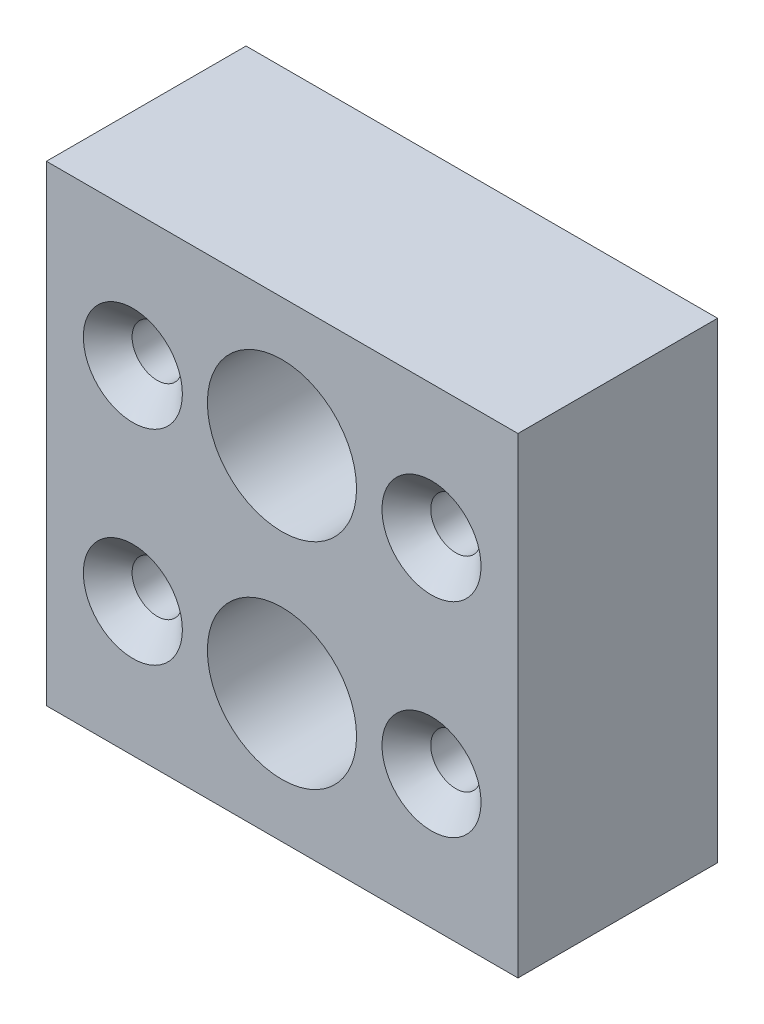
from build123d import *

# Parameters (mm, degrees)
SKETCH1_W                                       = 30
SKETCH1_H                                       = 30
BOSS_EXTRUDE1_DEPTH                             = 12.7
CSK_FOR_M3_FLAT_HEAD_MACHINE_SCREW1_D           = 3.2
CSK_FOR_M3_FLAT_HEAD_MACHINE_SCREW1_CSINK_D     = 6.3
CSK_FOR_M3_FLAT_HEAD_MACHINE_SCREW1_CSINK_ANGLE = 90


with BuildPart() as part:
    # Sketch1 → Boss-Extrude1 (new body)
    with BuildSketch(Plane.XY):
        Rectangle(SKETCH1_W, SKETCH1_H)
        with BuildLine():
            ThreePointArc((-8.9105463, -5.42101224), (-10.57898776, -5.9105463), (-10.0894537, -7.57898776))
            ThreePointArc((-10.0894537, -7.57898776), (-8.42101224, -7.0894537), (-8.9105463, -5.42101224))
        make_face(mode=Mode.SUBTRACT)
        with BuildLine():
            ThreePointArc((-8.9105463, 7.57898776), (-10.57898776, 7.0894537), (-10.0894537, 5.42101224))
            ThreePointArc((-10.0894537, 5.42101224), (-8.42101224, 5.9105463), (-8.9105463, 7.57898776))
        make_face(mode=Mode.SUBTRACT)
        with BuildLine():
            ThreePointArc((10.0894537, 7.57898776), (8.42101224, 7.0894537), (8.9105463, 5.42101224))
            ThreePointArc((8.9105463, 5.42101224), (10.57898776, 5.9105463), (10.0894537, 7.57898776))
        make_face(mode=Mode.SUBTRACT)
        with BuildLine():
            ThreePointArc((10.0894537, -5.42101224), (8.42101224, -5.9105463), (8.9105463, -7.57898776))
            ThreePointArc((8.9105463, -7.57898776), (10.57898776, -7.0894537), (10.0894537, -5.42101224))
        make_face(mode=Mode.SUBTRACT)
        with BuildLine():
            add(Edge.make_bspline(
                [(-1.342391508, -9.257231173), (-1.831415943, -8.990075907), (-2.180549698, -8.556474598), (-2.530193945, -8.122239293), (-2.686738964, -7.588310687), (-2.84359347, -7.053326516), (-2.783896578, -6.500133621), (-2.724081666, -5.945847074), (-2.457231173, -5.457608492), (-2.189853123, -4.968404672), (-1.756474598, -4.619450302), (-1.322239293, -4.269806055), (-0.788310687, -4.113261036), (-0.253326516, -3.95640653), (0.299866379, -4.016103422), (0.853868841, -4.075887677), (1.342391508, -4.342768827)],
                knots=[0, 0, 0, 0.125, 0.125, 0.25, 0.25, 0.375, 0.375, 0.5, 0.5, 0.625, 0.625, 0.75, 0.75, 0.875, 0.875, 1, 1, 1], degree=2))
            add(Edge.make_bspline(
                [(1.342391508, -4.342768827), (1.831415943, -4.609924093), (2.180549698, -5.043525402), (2.530193945, -5.477760707), (2.686738964, -6.011689313), (2.84359347, -6.546673484), (2.783896578, -7.099866379), (2.724081666, -7.654152926), (2.457231173, -8.142391508), (2.189853123, -8.631595328), (1.756474598, -8.980549698), (1.322239293, -9.330193945), (0.788310687, -9.486738964), (0.253326516, -9.64359347), (-0.299866379, -9.583896578), (-0.853868841, -9.524112323), (-1.342391508, -9.257231173)],
                knots=[0, 0, 0, 0.125, 0.125, 0.25, 0.25, 0.375, 0.375, 0.5, 0.5, 0.625, 0.625, 0.75, 0.75, 0.875, 0.875, 1, 1, 1], degree=2))
        make_face(mode=Mode.SUBTRACT)
        with BuildLine():
            add(Edge.make_bspline(
                [(1.342391508, 9.257231173), (1.831415943, 8.990075907), (2.180549698, 8.556474598), (2.530193945, 8.122239293), (2.686738964, 7.588310687), (2.84359347, 7.053326516), (2.783896578, 6.500133621), (2.724081666, 5.945847074), (2.457231173, 5.457608492), (2.189853123, 4.968404672), (1.756474598, 4.619450302), (1.322239293, 4.269806055), (0.788310687, 4.113261036), (0.253326516, 3.95640653), (-0.299866379, 4.016103422), (-0.853868841, 4.075887677), (-1.342391508, 4.342768827)],
                knots=[0, 0, 0, 0.125, 0.125, 0.25, 0.25, 0.375, 0.375, 0.5, 0.5, 0.625, 0.625, 0.75, 0.75, 0.875, 0.875, 1, 1, 1], degree=2))
            add(Edge.make_bspline(
                [(-1.342391508, 4.342768827), (-1.831415943, 4.609924093), (-2.180549698, 5.043525402), (-2.530193945, 5.477760707), (-2.686738964, 6.011689313), (-2.84359347, 6.546673484), (-2.783896578, 7.099866379), (-2.724081666, 7.654152926), (-2.457231173, 8.142391508), (-2.189853123, 8.631595328), (-1.756474598, 8.980549698), (-1.322239293, 9.330193945), (-0.788310687, 9.486738964), (-0.253326516, 9.64359347), (0.299866379, 9.583896578), (0.853868841, 9.524112323), (1.342391508, 9.257231173)],
                knots=[0, 0, 0, 0.125, 0.125, 0.25, 0.25, 0.375, 0.375, 0.5, 0.5, 0.625, 0.625, 0.75, 0.75, 0.875, 0.875, 1, 1, 1], degree=2))
        make_face(mode=Mode.SUBTRACT)
    extrude(amount=BOSS_EXTRUDE1_DEPTH)

    # CSK for M3 Flat Head Machine Screw1 (through all)
    with Locations(Plane.XY.offset(12.7)):
        with Locations((-9.5, -6.5), (-9.5, 6.5), (9.5, 6.5), (9.5, -6.5)):
            CounterSinkHole(CSK_FOR_M3_FLAT_HEAD_MACHINE_SCREW1_D / 2, CSK_FOR_M3_FLAT_HEAD_MACHINE_SCREW1_CSINK_D / 2, counter_sink_angle=CSK_FOR_M3_FLAT_HEAD_MACHINE_SCREW1_CSINK_ANGLE)

    # Sketch10 → 1/8 NPT Tapped Hole1 (revolve, cut)
    with BuildSketch(Plane(origin=(-0.014274842, -6.826129923, 12.7), x_dir=(0, -1, 0), z_dir=(1, 0, 0))):
        Polygon((0, 0), (0, 12.134668714), (4.2164, 9.6012), (4.2164, 6.92), (4.537398933, 6.92), (4.744593, 0), align=None)
    f_1_8_npt_tapped_hole1 = revolve(axis=Axis((-0.014274842, -6.826129923, 19.05), (0, 0, -1)), mode=Mode.SUBTRACT)

    # Mirror1: 1/8 NPT Tapped Hole1 across plane
    add(f_1_8_npt_tapped_hole1.mirror(Plane.ZX), mode=Mode.SUBTRACT)


solid = part.part
